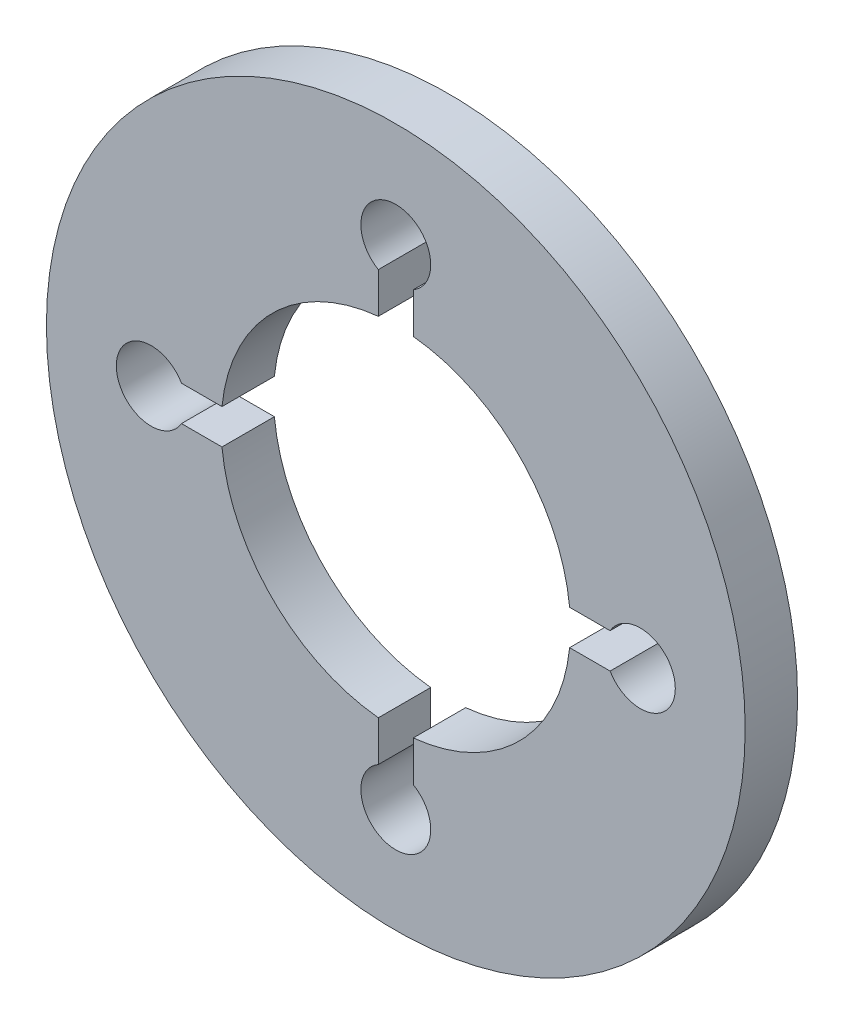
from build123d import *

# Parameters (mm, degrees)
ESQUISSE1_R        = 5
BOSS_EXTRU_1_DEPTH = 0.75


with BuildPart() as part:
    # Esquisse1 → Boss.-Extru.1 (new body)
    with BuildSketch(Plane.XY):
        Circle(ESQUISSE1_R)
        with BuildLine():
            Line((3.066987298, 0.25), (2.487468593, 0.25))
            ThreePointArc((2.487468593, 0.25), (1.767766953, 1.767766953), (0.25, 2.487468593))
            Line((0.25, 2.487468593), (0.25, 3.066987298))
            ThreePointArc((0.25, 3.066987298), (0, 4), (-0.25, 3.066987298))
            Line((-0.25, 3.066987298), (-0.25, 2.487468593))
            ThreePointArc((-0.25, 2.487468593), (-1.767766953, 1.767766953), (-2.487468593, 0.25))
            Line((-2.487468593, 0.25), (-3.066987298, 0.25))
            ThreePointArc((-3.066987298, 0.25), (-4, 0), (-3.066987298, -0.25))
            Line((-3.066987298, -0.25), (-2.487468593, -0.25))
            ThreePointArc((-2.487468593, -0.25), (-1.767766953, -1.767766953), (-0.25, -2.487468593))
            Line((-0.25, -2.487468593), (-0.25, -3.066987298))
            ThreePointArc((-0.25, -3.066987298), (0, -4), (0.25, -3.066987298))
            Line((0.25, -3.066987298), (0.25, -2.487468593))
            ThreePointArc((0.25, -2.487468593), (1.767766953, -1.767766953), (2.487468593, -0.25))
            Line((2.487468593, -0.25), (3.066987298, -0.25))
            ThreePointArc((3.066987298, -0.25), (4, 0), (3.066987298, 0.25))
        make_face(mode=Mode.SUBTRACT)
    extrude(amount=BOSS_EXTRU_1_DEPTH)


solid = part.part
